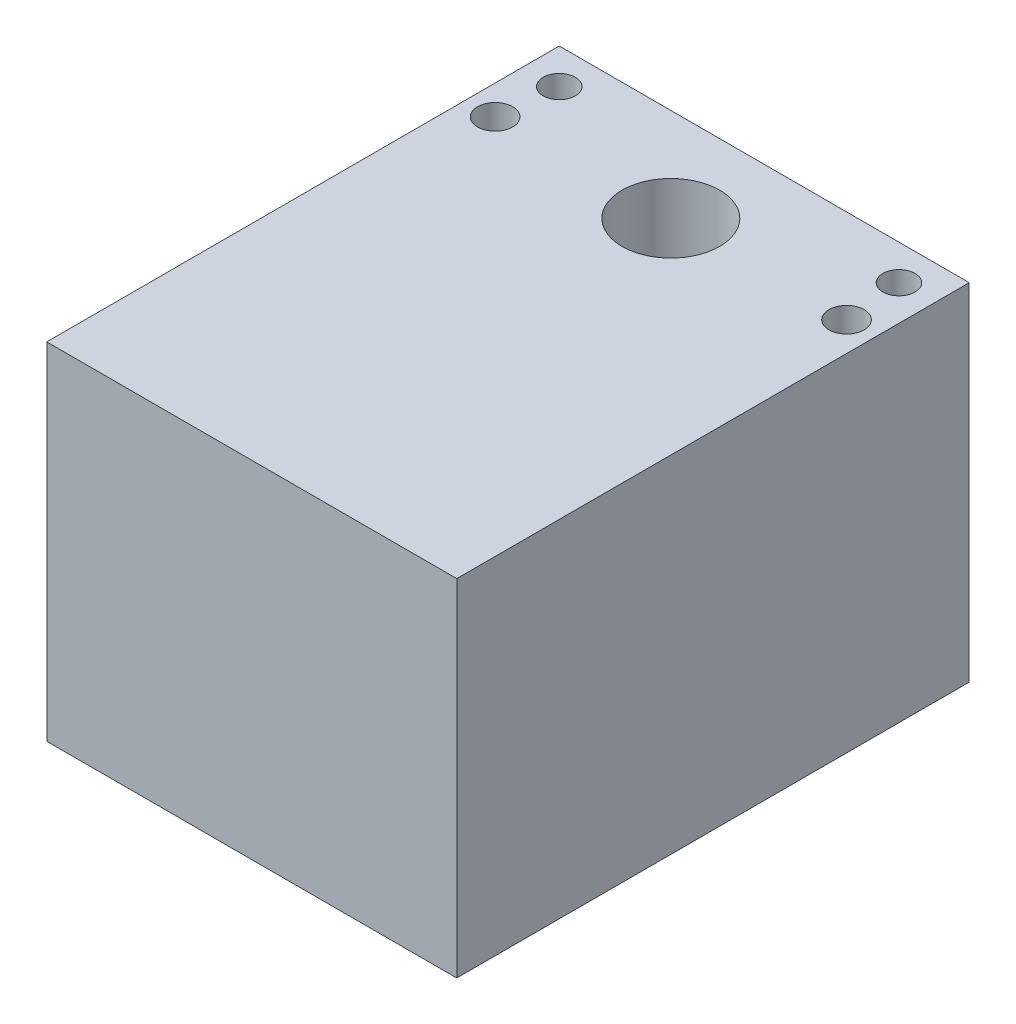
from build123d import *

# Parameters (mm, degrees)
SKETCH_1_W      = 35.56
SKETCH_1_H      = 44.45
SKETCH_1_R      = 1.397
SKETCH_1_R_2    = 1.524
SKETCH_1_R_3    = 4.233333333
EXTRUDE_1_DEPTH = 30


with BuildPart() as part:
    # 草图1 → 凸台-拉伸1 (new body)
    with BuildSketch(Plane(origin=(0, 0, 0), x_dir=(1, 0, 0), z_dir=(0, 1, 0))):
        Rectangle(SKETCH_1_W, SKETCH_1_H)
        with Locations(Location((-14.732, 19.177, 0), (0, 0, 270))):
            Circle(SKETCH_1_R, mode=Mode.SUBTRACT)
        with Locations(Location((14.732, 19.177, 0), (0, 0, 270))):
            Circle(SKETCH_1_R, mode=Mode.SUBTRACT)
        with Locations(Location((-15.24, 14.122, 0), (0, 0, 270))):
            Circle(SKETCH_1_R_2, mode=Mode.SUBTRACT)
        with Locations(Location((15.24, 14.122, 0), (0, 0, 270))):
            Circle(SKETCH_1_R_2, mode=Mode.SUBTRACT)
        with Locations(Location((0, 14.122, 0), (0, 0, 270))):
            Circle(SKETCH_1_R_3, mode=Mode.SUBTRACT)
    extrude(amount=EXTRUDE_1_DEPTH)


solid = part.part
